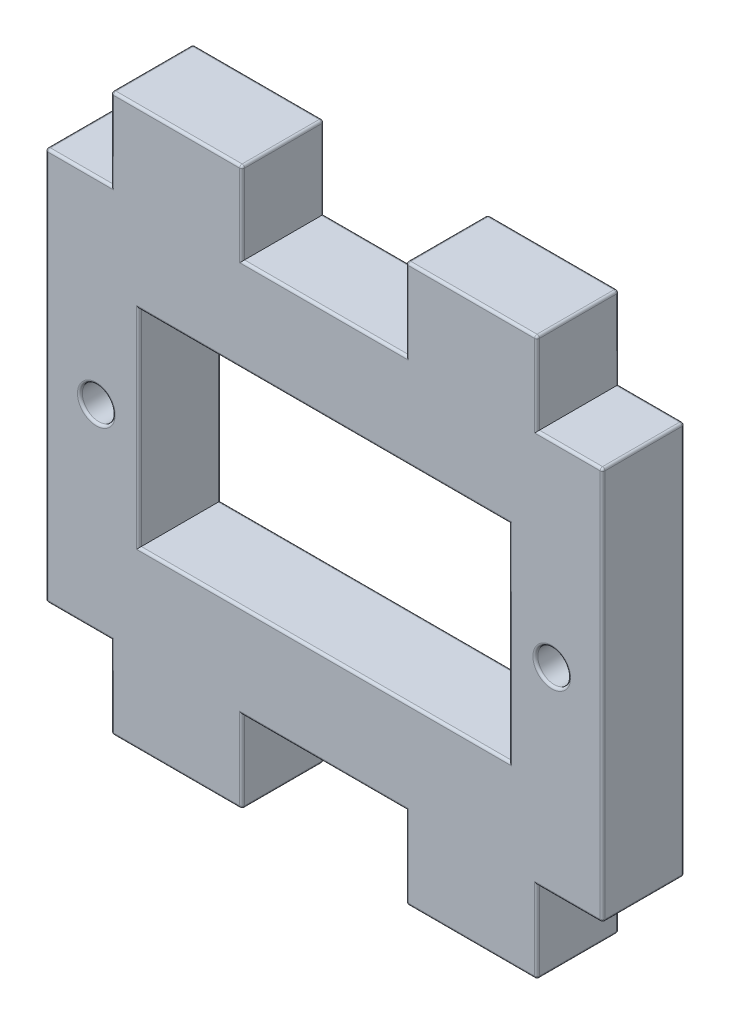
from build123d import *

# Parameters (mm, degrees)
SKETCH1_R           = 1
SKETCH1_W           = 22.6
SKETCH1_H           = 12.6
BOSS_EXTRUDE1_DEPTH = 2.5
FILLET1_R           = 0.15


with BuildPart() as part:
    # Sketch1 → Boss-Extrude1 (new, symmetric)
    with BuildSketch(Plane.XY):
        Polygon((-5, 17), (-13, 17), (-13, 12), (-17, 12), (-17, -12), (-13, -12), (-13, -17), (-5, -17), (-5, -12), (5, -12), (5, -17), (13, -17), (13, -12), (17, -12), (17, 12), (13, 12), (13, 17), (5, 17), (5, 12), (-5, 12), align=None)
        with Locations((13.9, 0)):
            Circle(SKETCH1_R, mode=Mode.SUBTRACT)
        with Locations((-13.9, 0)):
            Circle(SKETCH1_R, mode=Mode.SUBTRACT)
        Rectangle(SKETCH1_W, SKETCH1_H, mode=Mode.SUBTRACT)
    extrude(amount=BOSS_EXTRUDE1_DEPTH, both=True)

    # Fillet1
    fillet1_edges = [part.edges().sort_by_distance(p)[0] for p in [
        (11.3, 0, 2.5),
        (0, -6.3, 2.5),
        (-11.3, 0, 2.5),
        (0, 6.3, 2.5),
        (-14.9, 0, 2.5),
        (12.9, 0, 2.5),
        (-15, -12, 2.5),
        (-13, -14.5, 2.5),
        (-9, -17, 2.5),
        (12.9, 0, -2.5),
        (-5, -14.5, 2.5),
        (-14.9, 0, -2.5),
        (0, 6.3, -2.5),
        (-11.3, 0, -2.5),
        (0, -6.3, -2.5),
        (11.3, 0, -2.5),
        (-15, 12, -2.5),
        (-13, 14.5, -2.5),
        (-9, 17, -2.5),
        (0, -12, 2.5),
        (-5, 14.5, -2.5),
        (0, 12, -2.5),
        (5, 14.5, -2.5),
        (9, 17, -2.5),
        (13, 14.5, -2.5),
        (15, 12, -2.5),
        (17, 0, -2.5),
        (15, -12, -2.5),
        (13, -14.5, -2.5),
        (9, -17, -2.5),
        (5, -14.5, 2.5),
        (5, -14.5, -2.5),
        (0, -12, -2.5),
        (-5, -14.5, -2.5),
        (-9, -17, -2.5),
        (-13, -14.5, -2.5),
        (-15, -12, -2.5),
        (-17, 0, -2.5),
        (9, -17, 2.5),
        (13, -14.5, 2.5),
        (-17, 12, 0),
        (-13, 17, 0),
        (-5, 17, 0),
        (5, 17, 0),
        (13, 17, 0),
        (15, -12, 2.5),
        (17, 12, 0),
        (17, -12, 0),
        (13, -17, 0),
        (5, -17, 0),
        (-5, -17, 0),
        (-13, -17, 0),
        (-17, -12, 0),
        (17, 0, 2.5),
        (15, 12, 2.5),
        (13, 14.5, 2.5),
        (9, 17, 2.5),
        (5, 14.5, 2.5),
        (0, 12, 2.5),
        (-17, 0, 2.5),
        (-5, 14.5, 2.5),
        (-9, 17, 2.5),
        (-13, 14.5, 2.5),
        (-15, 12, 2.5),
    ]]
    fillet(fillet1_edges, radius=FILLET1_R)


solid = part.part
